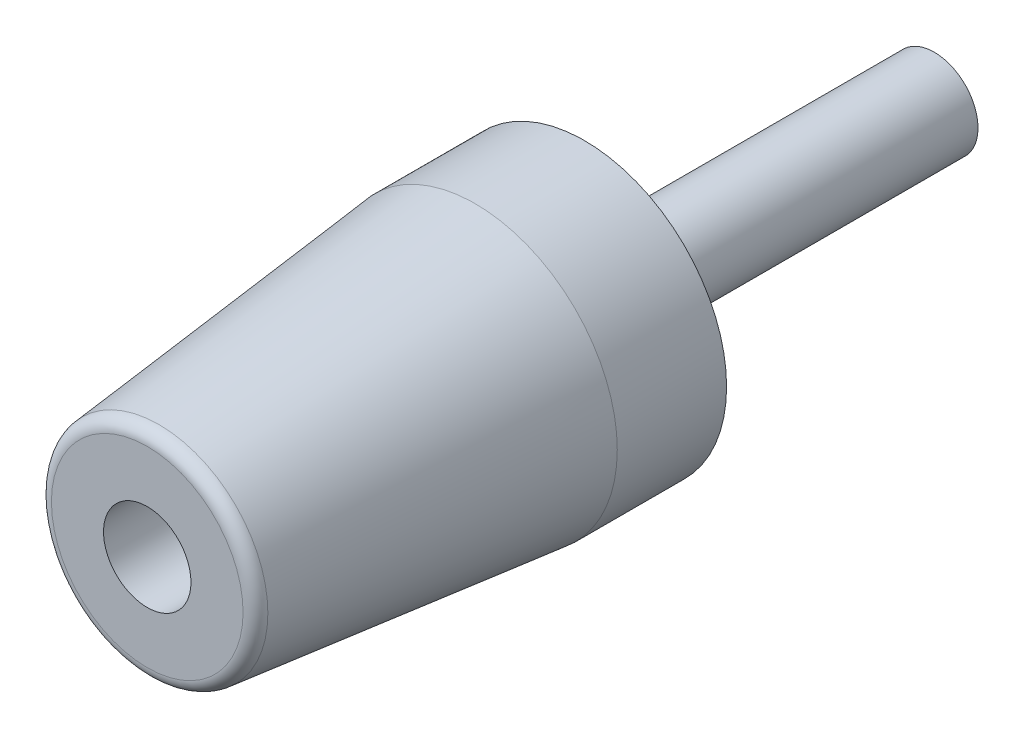
from build123d import *

# Parameters (mm, degrees)
SKETCH_1_R          = 2
EXTRUDE_1_DEPTH     = 36
SKETCH_2_R          = 6.5
EXTRUDE_2_DEPTH     = 5
SKETCH_3_R          = 6.5
EXTRUDE_3_DEPTH     = 15
EXTRUDE_3_TAPER     = 6
CUT_EXTRUDE_START   = -13
SKETCH_4_R          = 2
CUT_EXTRUDE_1_DEPTH = 13
FILLET_1_R          = 0.6


with BuildPart() as part:
    # 草图1 → 凸台-拉伸1 (new body)
    with BuildSketch(Plane.XY):
        Circle(SKETCH_1_R)
    extrude(amount=EXTRUDE_1_DEPTH)

    # 草图2 → 凸台-拉伸2 (add)
    with BuildSketch(Plane.XY.offset(16)):
        Circle(SKETCH_2_R)
    extrude(amount=EXTRUDE_2_DEPTH)

    # 草图3 → 凸台-拉伸3 (add)
    with BuildSketch(Plane.XY.offset(21)):
        Circle(SKETCH_3_R)
    extrude(amount=EXTRUDE_3_DEPTH, taper=EXTRUDE_3_TAPER)

    # 草图4 → 切除-拉伸1 (cut)
    with BuildSketch(Plane.XY.offset(36).offset(CUT_EXTRUDE_START)):
        Circle(SKETCH_4_R)
    extrude(amount=CUT_EXTRUDE_1_DEPTH, mode=Mode.SUBTRACT)

    # 圆角1
    fillet_1_edges = [part.edges().sort_by_distance(p)[0] for p in [
        (-4.923436471, 0, 36),
    ]]
    fillet(fillet_1_edges, radius=FILLET_1_R)


solid = part.part
